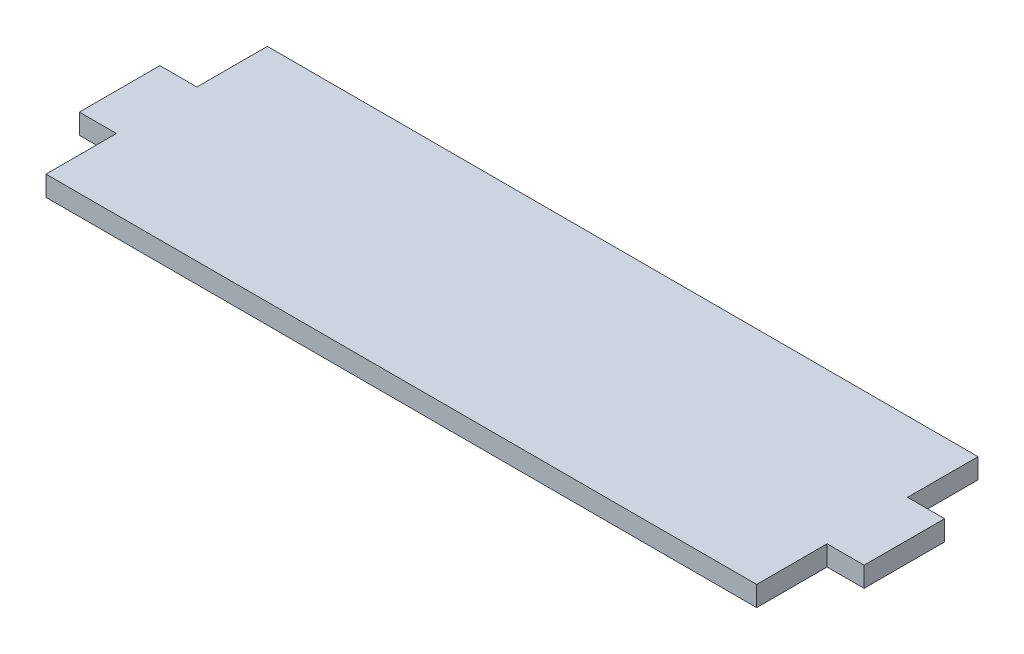
from build123d import *

# Parameters (mm, degrees)
BOSS_EXTRUDE1_DEPTH = 3.175


with BuildPart() as part:
    # Sketch1 → Boss-Extrude1 (new body)
    with BuildSketch(Plane(origin=(0, 0, 0), x_dir=(1, 0, 0), z_dir=(0, 1, 0))):
        Polygon((56.0705, -17.4625), (-56.0705, -17.4625), (-56.0705, -6.35), (-61.9125, -6.35), (-61.9125, 6.35), (-56.0705, 6.35), (-56.0705, 17.4625), (56.0705, 17.4625), (56.0705, 6.35), (61.9125, 6.35), (61.9125, -6.35), (56.0705, -6.35), align=None)
    extrude(amount=BOSS_EXTRUDE1_DEPTH)


solid = part.part
